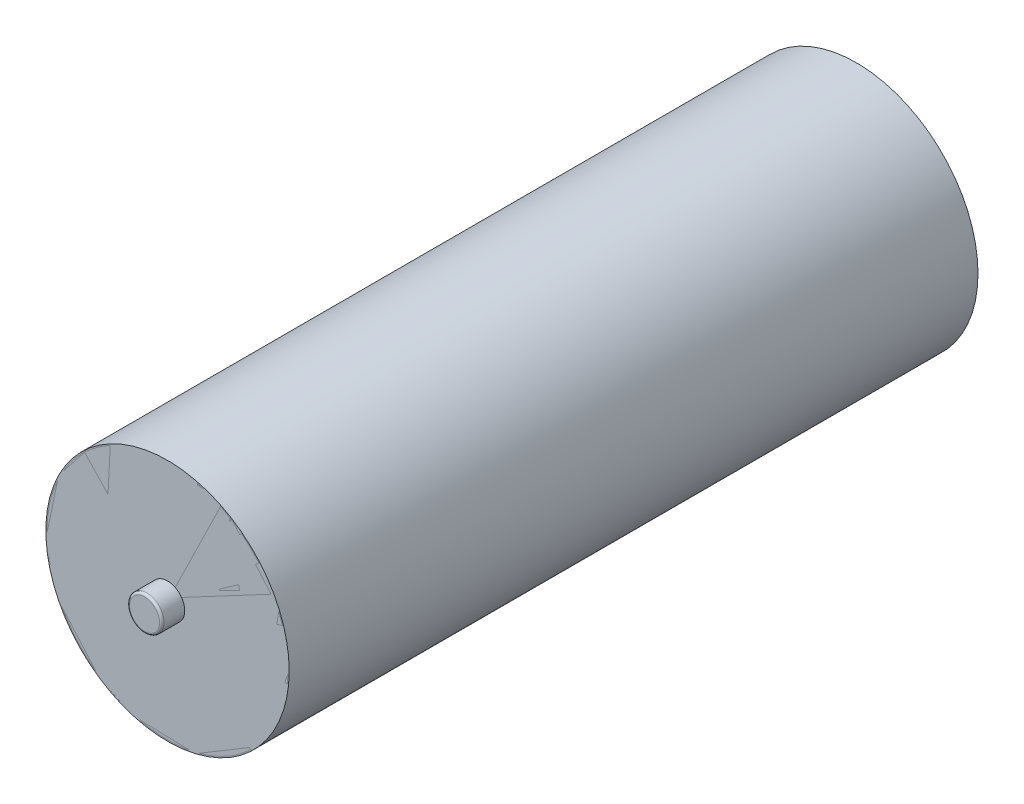
from build123d import *

# Parameters (mm, degrees)
SCHIZZO1_R                        = 52.5
ESTRUSIONE_ESTRUSIONE1_DEPTH      = 150
ESTRUSIONE_ESTRUSIONE2_START      = 150
SCHIZZO2_R                        = 52.5
ESTRUSIONE_ESTRUSIONE2_DEPTH      = 150
SCHIZZO3_R                        = 7.5
ESTRUSIONE_ESTRUSIONE3_DEPTH      = 10
RACCORDO1_R                       = 1
ESTRUSIONE_ESTRUSIONE4_START      = 10
SCHIZZO4_R                        = 7.5
ESTRUSIONE_ESTRUSIONE4_DEPTH      = 10
RACCORDO2_R                       = 1
ESTRUSIONE_ESTRUSIONE6_DEPTH      = 150
ESTRUSIONE_ESTRUSIONE6_DEPTH_BACK = 150
SCHIZZO8_R                        = 53


with BuildPart() as part:
    # Schizzo1 → Estrusione-Estrusione1 (new body)
    with BuildSketch(Plane.XY):
        Circle(SCHIZZO1_R)
    extrude(amount=ESTRUSIONE_ESTRUSIONE1_DEPTH)

    # Schizzo2 → Estrusione-Estrusione2 (add)
    with BuildSketch(Plane(origin=(0, 0, 0), x_dir=(-1, 0, 0), z_dir=(0, 0, -1)).offset(ESTRUSIONE_ESTRUSIONE2_START)):
        Circle(SCHIZZO2_R)
    extrude(amount=-ESTRUSIONE_ESTRUSIONE2_DEPTH)

    # Schizzo3 → Estrusione-Estrusione3 (add)
    with BuildSketch(Plane(origin=(0, 0, -150), x_dir=(-1, 0, 0), z_dir=(0, 0, -1))):
        Circle(SCHIZZO3_R)
    extrude(amount=ESTRUSIONE_ESTRUSIONE3_DEPTH)

    # Raccordo1
    raccordo1_edges = [part.edges().sort_by_distance(p)[0] for p in [
        (7.5, 0, -160),
    ]]
    fillet(raccordo1_edges, radius=RACCORDO1_R)

    # Schizzo4 → Estrusione-Estrusione4 (add)
    with BuildSketch(Plane.XY.offset(150).offset(ESTRUSIONE_ESTRUSIONE4_START)):
        with Locations(Location((0, 0, 0), (0, 0, 180))):
            Circle(SCHIZZO4_R)
    extrude(amount=-ESTRUSIONE_ESTRUSIONE4_DEPTH)

    # Raccordo2
    raccordo2_edges = [part.edges().sort_by_distance(p)[0] for p in [
        (7.5, 0, 160),
    ]]
    fillet(raccordo2_edges, radius=RACCORDO2_R)


with BuildPart() as body_2:
    # Schizzo8 → Estrusione-Estrusione6 (new, two sides: drawn at the far end of the back side and taken through both)
    with BuildSketch(Plane.XY.offset(-ESTRUSIONE_ESTRUSIONE6_DEPTH_BACK)):
        Circle(SCHIZZO8_R)
    extrude(amount=ESTRUSIONE_ESTRUSIONE6_DEPTH + ESTRUSIONE_ESTRUSIONE6_DEPTH_BACK)


solid = Compound([part.part, body_2.part])
